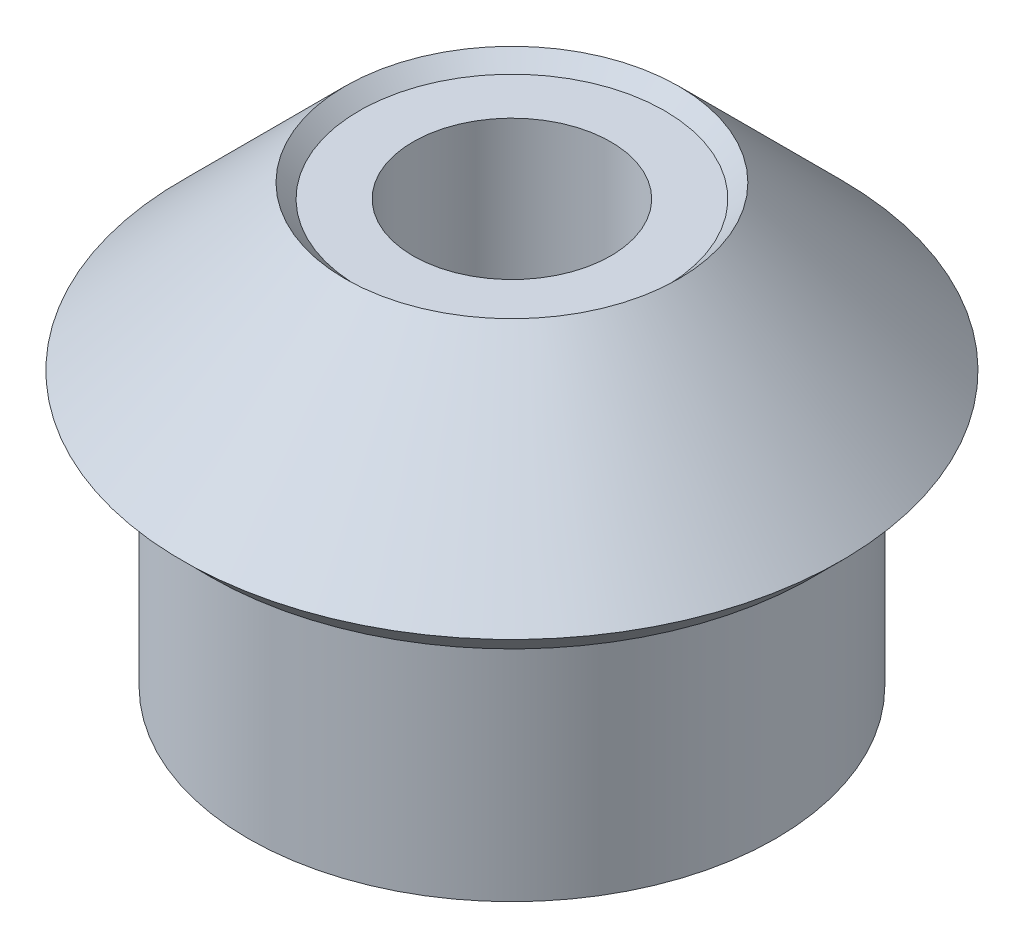
from build123d import *

# Parameters (mm, degrees)
SKETCH_3_R          = 3
CUT_EXTRUDE_1_DEPTH = 20.082943622


with BuildPart() as part:
    # 草图1 → 旋转1 (revolve)
    with BuildSketch(Plane.XY, mode=Mode.PRIVATE) as revolve_1_sk:
        Polygon((9.151470081, 7.456074104), (8, 7.456074104), (8, 0), (0, 0), (0, 12.812447406), (4.63300477, 12.812447406), (5.062578912, 13.242021548), (9.999998219, 8.304602242), align=None)
    revolve(revolve_1_sk.sketch.rotate(Axis((0, 0, 0), (0, 1, 0)), 90), axis=Axis((0, 0, 0), (0, 1, 0)))

    # 草图3 → 切除-拉伸1 (cut, through all)
    with BuildSketch(Plane(origin=(0, 12.812447406, 0), x_dir=(1, 0, 0), z_dir=(0, 1, 0))):
        with Locations(Location((0, 0, 0), (0, 0, 270))):
            Circle(SKETCH_3_R)
    extrude(amount=-CUT_EXTRUDE_1_DEPTH, mode=Mode.SUBTRACT)


solid = part.part
